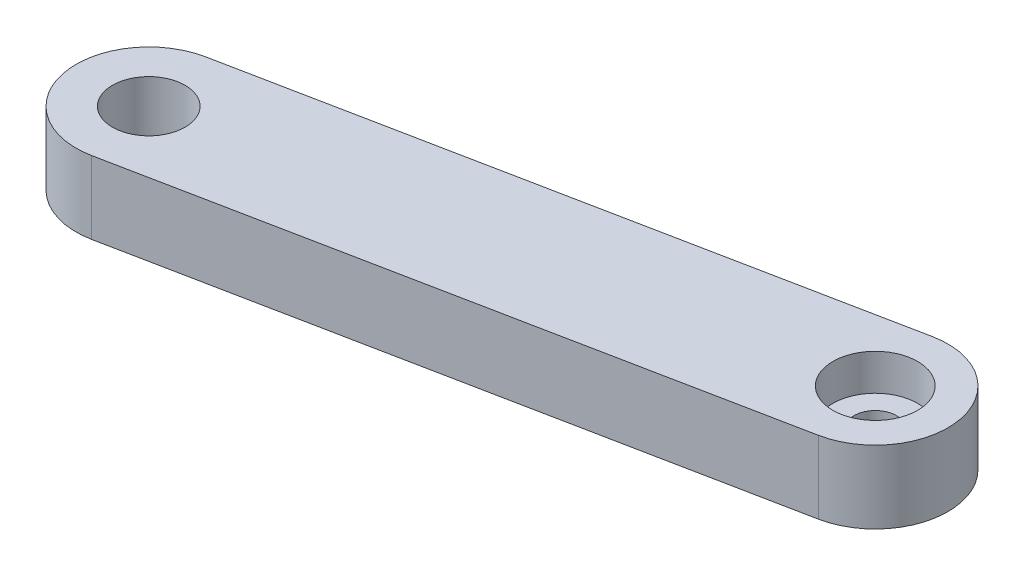
from build123d import *

# Parameters (mm, degrees)
SKETCH1_R           = 1.75
SKETCH1_R_2         = 3
BOSS_EXTRUDE1_DEPTH = 6
SKETCH2_R           = 3.5
CUT_EXTRUDE1_DEPTH  = 3


with BuildPart() as part:
    # Sketch1 → Boss-Extrude1 (new body)
    with BuildSketch(Plane(origin=(0, 0, 0), x_dir=(1, 0, 0), z_dir=(0, 1, 0))):
        with BuildLine():
            Line((1.176696811, -5.883484054), (-48.823303189, -15.883484054))
            ThreePointArc((-48.823303189, -15.883484054), (-55.883484054, -11.176696811), (-51.176696811, -4.116515946))
            Line((-51.176696811, -4.116515946), (-1.176696811, 5.883484054))
            ThreePointArc((-1.176696811, 5.883484054), (5.883484054, 1.176696811), (1.176696811, -5.883484054))
        make_face()
        with Locations(Location((0, 0, 0), (0, 0, 270))):
            Circle(SKETCH1_R, mode=Mode.SUBTRACT)
        with Locations(Location((-50, -10, 0), (0, 0, 270))):
            Circle(SKETCH1_R_2, mode=Mode.SUBTRACT)
    extrude(amount=BOSS_EXTRUDE1_DEPTH)

    # Sketch2 → Cut-Extrude1 (cut)
    with BuildSketch(Plane(origin=(0, 6, 0), x_dir=(1, 0, 0), z_dir=(0, 1, 0))):
        with Locations(Location((0, 0, 0), (0, 0, 270))):
            Circle(SKETCH2_R)
    extrude(amount=-CUT_EXTRUDE1_DEPTH, mode=Mode.SUBTRACT)


solid = part.part
